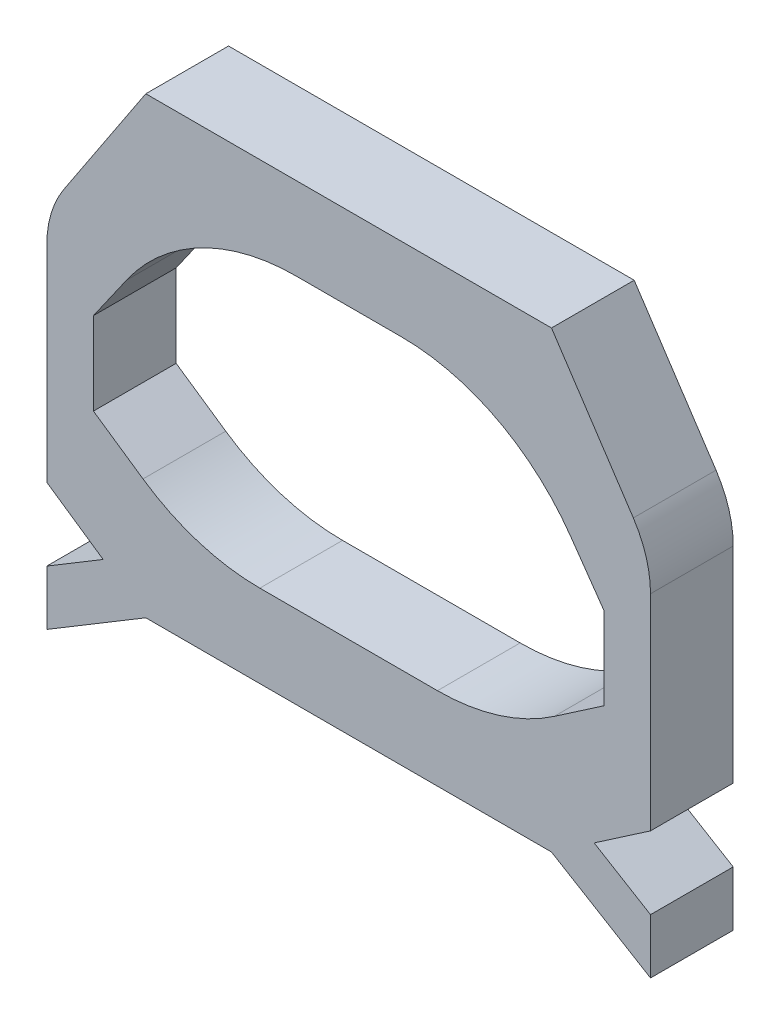
from build123d import *

# Parameters (mm, degrees)
BOSS_EXTRUDE1_DEPTH      = 5.08
BOSS_EXTRUDE1_DEPTH_BACK = 5.08
BOSS_EXTRUDE1_START      = -15.3035
FILLET1_R                = 12.7
FILLET2_R                = 12.7
FILLET3_R                = 25.4
BOSS_EXTRUDE2_DEPTH      = 10.16
CUT_EXTRUDE1_DEPTH       = 2.032
CUT_EXTRUDE1_DEPTH_BACK  = 2.032


with BuildPart() as part:
    # Sketch1 → Boss-Extrude1 (new, two sides: drawn at the far end of the back side and taken through both)
    with BuildSketch(Plane.XY.offset(132.610741806).offset(BOSS_EXTRUDE1_START - BOSS_EXTRUDE1_DEPTH_BACK)):
        Polygon((-83.578638746, 26.563044496), (-83.578638746, 12.034244496), (-71.412108995, 3.703044496), (-21.577168497, 3.703044496), (-9.410638746, 12.034244496), (-9.410638746, 26.563044496), (-9.410638746, 41.086800568), (-21.577168497, 59.456669294), (-71.412108995, 59.456669294), (-83.578638746, 41.086800568), align=None)
        Polygon((-65.266559293, 13.863044496), (-77.846462947, 22.47730801), (-77.846462947, 32.63730801), (-66.181452594, 49.296669294), (-26.807824897, 49.296669294), (-15.142814545, 32.63730801), (-15.142814545, 22.47730801), (-27.722718198, 13.863044496), align=None, mode=Mode.SUBTRACT)
    extrude(amount=BOSS_EXTRUDE1_DEPTH + BOSS_EXTRUDE1_DEPTH_BACK)

    # Fillet1
    fillet1_edges = [part.edges().sort_by_distance(p)[0] for p in [
        (-9.410638746, 41.086800568, 117.307241806),
    ]]
    fillet(fillet1_edges, radius=FILLET1_R)

    # Fillet2
    fillet2_edges = [part.edges().sort_by_distance(p)[0] for p in [
        (-83.578638746, 41.086800568, 117.307241806),
    ]]
    fillet(fillet2_edges, radius=FILLET2_R)

    # Fillet3
    fillet3_edges = [part.edges().sort_by_distance(p)[0] for p in [
        (-65.266559293, 13.863044496, 117.307241806),
        (-27.722718198, 13.863044496, 117.307241806),
        (-26.807824897, 49.296669294, 117.307241806),
        (-66.181452594, 49.296669294, 117.307241806),
    ]]
    fillet(fillet3_edges, radius=FILLET3_R)

    # Sketch2 → Boss-Extrude2 (add)
    with BuildSketch(Plane.XY.offset(122.387241806)):
        Polygon((-83.578638746, -3.617199432), (-71.412108995, 3.703044496), (-76.651458613, 7.290761818), (-83.578638746, 3.122880808), align=None)
    boss_extrude2 = extrude(amount=-BOSS_EXTRUDE2_DEPTH)

    # Mirror1: Boss-Extrude2 across plane
    add(boss_extrude2.mirror(Plane(origin=(-46.494638746, 0, 0), x_dir=(0, 0, 1), z_dir=(1, 0, 0))))

    # Sketch3 → Cut-Extrude1 (cut, two sides: drawn at the far end of the back side and taken through both)
    with BuildSketch(Plane(origin=(0, 0, 117.307241806), x_dir=(-1, 0, 0), z_dir=(0, 0, -1)).offset(-CUT_EXTRUDE1_DEPTH_BACK)):
        Polygon((24.891011245, 56.456669294), (68.21883105, 56.456669294), (79.016596447, 39.586472788), (68.21883105, 52.296669294), (24.891011245, 52.296669294), (14.093245849, 39.586472788), align=None)
        Polygon((79.016596447, 19.036634436), (79.016596447, 12.857149387), (70.121493391, 6.703044496), (22.988348904, 6.703044496), (14.093245849, 12.857149387), (14.093245849, 19.036634436), (26.029608579, 10.863044496), (67.080233717, 10.863044496), align=None)
    extrude(amount=CUT_EXTRUDE1_DEPTH + CUT_EXTRUDE1_DEPTH_BACK, mode=Mode.SUBTRACT)


solid = part.part
